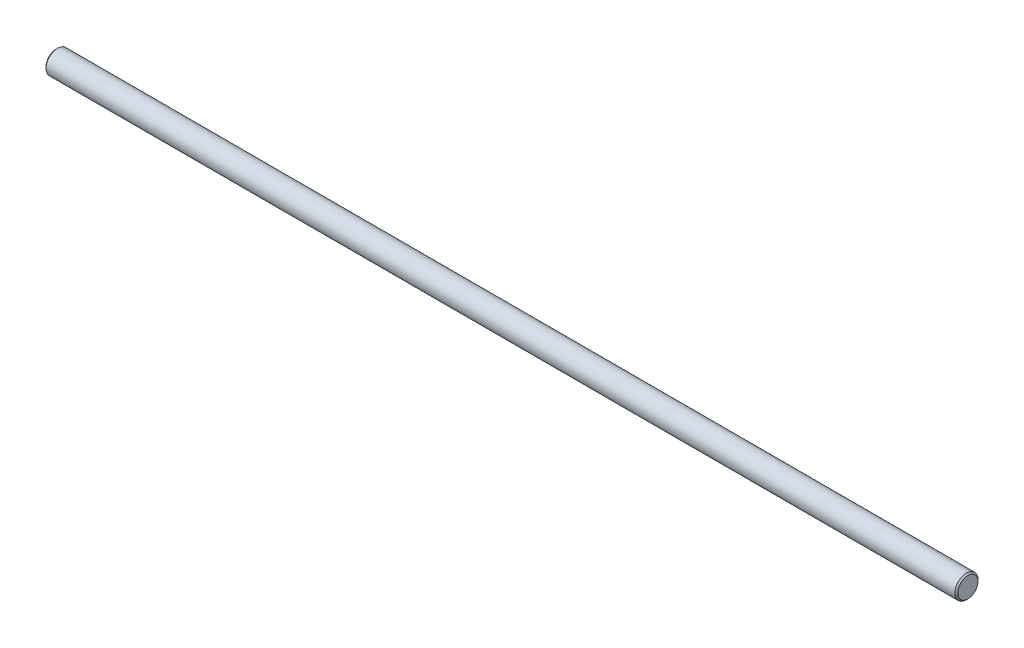
from build123d import *


with BuildPart() as part:
    # Sketch1 → Revolve1 (revolve)
    with BuildSketch(Plane.XY, mode=Mode.PRIVATE) as revolve1_sk:
        Polygon((0, 3.5), (0, 0), (315, 0), (315, 3.5), (314.5, 4), (0.5, 4), align=None)
    revolve(revolve1_sk.sketch.rotate(Axis((0, 0, 0), (1, 0, 0)), 270), axis=Axis((0, 0, 0), (1, 0, 0)))


solid = part.part
